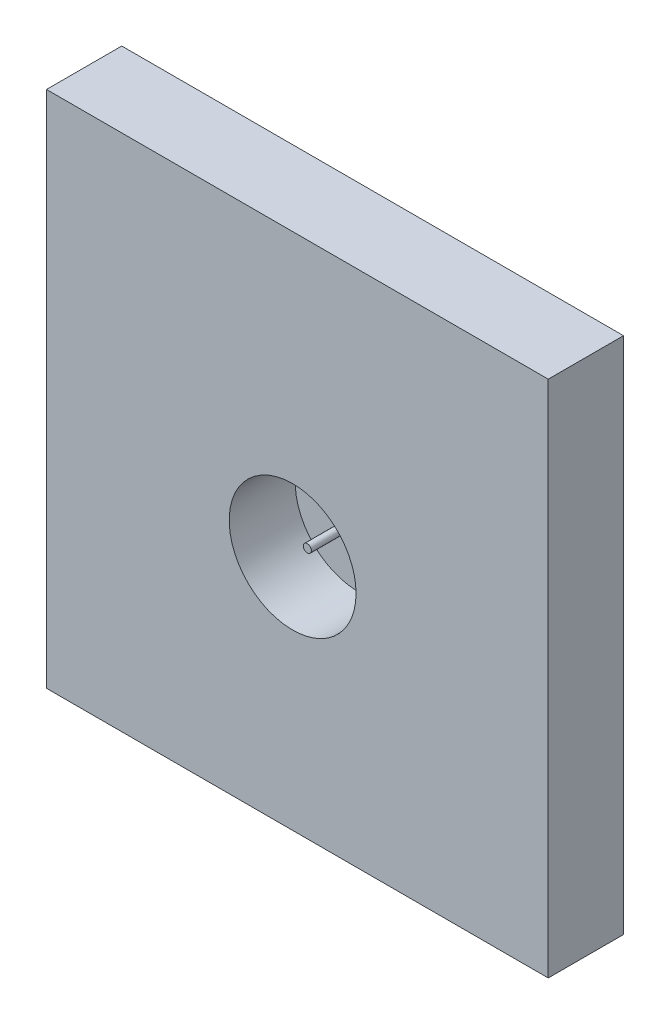
from build123d import *

# Parameters (mm, degrees)
BOSS_EXTRUDE1_DEPTH      = 6196
BOSS_EXTRUDE1_DEPTH_BACK = 4329
SKETCH1_W                = 1578.701976668
SKETCH1_H                = 10878.961606317
SKETCH3_R                = 1330.449328347
CUT_EXTRUDE1_DEPTH       = 1384
SKETCH4_R                = 84.807211279
BOSS_EXTRUDE2_DEPTH      = 1270


with BuildPart() as part:
    # Sketch1 → Boss-Extrude1 (new, two sides: drawn at the far end of the back side and taken through both)
    with BuildSketch(Plane(origin=(0, 0, 0), x_dir=(0, 0, -1), z_dir=(1, 0, 0)).offset(-BOSS_EXTRUDE1_DEPTH_BACK)):
        with Locations((-154.159787834, -728.170853353)):
            Rectangle(SKETCH1_W, SKETCH1_H)
    extrude(amount=BOSS_EXTRUDE1_DEPTH + BOSS_EXTRUDE1_DEPTH_BACK)

    # Sketch3 → Cut-Extrude1 (cut)
    with BuildSketch(Plane.XY.offset(943.510776168)):
        with Locations((833.930631376, -1197.16637306)):
            Circle(SKETCH3_R)
    extrude(amount=-CUT_EXTRUDE1_DEPTH, mode=Mode.SUBTRACT)

    # Sketch4 → Boss-Extrude2 (add)
    with BuildSketch(Plane(origin=(0, 0, -635.1912005), x_dir=(-1, 0, 0), z_dir=(0, 0, -1))):
        with Locations(Location((-833.930631376, -1197.16637306, 0), (0, 0, 90))):
            Circle(SKETCH4_R)
    extrude(amount=-BOSS_EXTRUDE2_DEPTH)


solid = part.part
